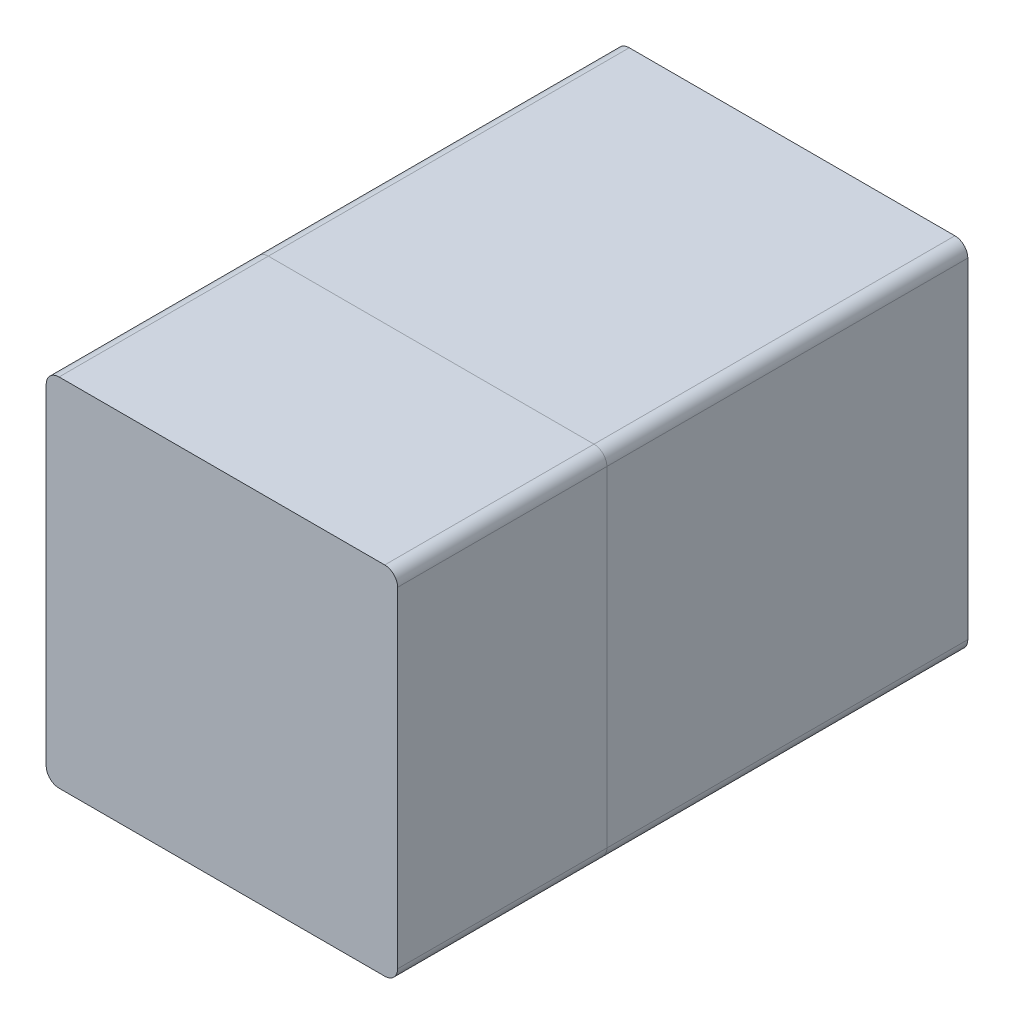
from build123d import *

# Parameters (mm, degrees)
SKETCH1_W           = 73.787
SKETCH1_H           = 72.898
BOSS_EXTRUDE1_DEPTH = 123.698
SHELL1_T            = 4
SKETCH2_W           = 81.787
SKETCH2_H           = 80.898
SKETCH2_W_2         = 73.787
SKETCH2_H_2         = 72.898
BOSS_EXTRUDE2_DEPTH = 1
SKETCH7_W           = 81.787
SKETCH7_H           = 80.898
BOSS_EXTRUDE5_DEPTH = 4
SKETCH3_W           = 81.787
SKETCH3_H           = 132.698
BOSS_EXTRUDE3_DEPTH = 2
SKETCH4_R           = 3.025
CUT_EXTRUDE2_DEPTH  = 5
FILLET1_R           = 3
SKETCH5_W           = 77.787
SKETCH5_H           = 76.898
SKETCH5_W_2         = 73.787
SKETCH5_H_2         = 72.898
BOSS_EXTRUDE4_DEPTH = 20
SKETCH6_W           = 78.087
SKETCH6_H           = 77.198
CUT_EXTRUDE3_DEPTH  = 21


with BuildPart() as part:
    # Sketch1 → Boss-Extrude1 (new body)
    with BuildSketch(Plane.XY):
        Rectangle(SKETCH1_W, SKETCH1_H)
    extrude(amount=BOSS_EXTRUDE1_DEPTH)

    # Shell1
    shell1_openings = [part.faces().sort_by_distance(p)[0] for p in [
        (0, 0, 123.698),
    ]]
    offset(amount=SHELL1_T, openings=shell1_openings, kind=Kind.INTERSECTION)

    # Sketch2 → Boss-Extrude2 (add)
    with BuildSketch(Plane.XY.offset(123.698)):
        Rectangle(SKETCH2_W, SKETCH2_H)
        Rectangle(SKETCH2_W_2, SKETCH2_H_2, mode=Mode.SUBTRACT)
    extrude(amount=BOSS_EXTRUDE2_DEPTH)

    # Sketch7 → Boss-Extrude5 (add)
    with BuildSketch(Plane.XY.offset(124.698)):
        Rectangle(SKETCH7_W, SKETCH7_H)
    extrude(amount=BOSS_EXTRUDE5_DEPTH)

    # Sketch3 → Boss-Extrude3 (add)
    with BuildSketch(Plane.XZ.offset(40.449)):
        with Locations((0, 62.349)):
            Rectangle(SKETCH3_W, SKETCH3_H)
    extrude(amount=BOSS_EXTRUDE3_DEPTH)

    # Sketch4 → Cut-Extrude2 (cut)
    with BuildSketch(Plane.XZ.offset(42.449)):
        with Locations((-22.225, 109.648)):
            Circle(SKETCH4_R)
        with Locations((22.225, 109.648)):
            Circle(SKETCH4_R)
        with Locations((-22.225, 15.05)):
            Circle(SKETCH4_R)
        with Locations((22.225, 15.05)):
            Circle(SKETCH4_R)
    extrude(amount=-CUT_EXTRUDE2_DEPTH, mode=Mode.SUBTRACT)

    # Fillet1
    fillet1_edges = [part.edges().sort_by_distance(p)[0] for p in [
        (-40.8935, -42.449, 62.349),
        (40.8935, -42.449, 62.349),
        (40.8935, 40.449, 62.349),
        (-40.8935, 40.449, 62.349),
    ]]
    fillet(fillet1_edges, radius=FILLET1_R)


with BuildPart() as body_2:
    # Split1: the piece on the far side of the plane
    add(part.part)
    split(bisect_by=Plane.XY.offset(80), keep=Keep.BOTTOM)

    # Sketch5 → Boss-Extrude4 (add)
    with BuildSketch(Plane.XY.offset(80)):
        Rectangle(SKETCH5_W, SKETCH5_H)
        Rectangle(SKETCH5_W_2, SKETCH5_H_2, mode=Mode.SUBTRACT)
    extrude(amount=BOSS_EXTRUDE4_DEPTH)


with BuildPart() as part_1:
    add(part.part)

    # Split1
    split(bisect_by=Plane.XY.offset(80), keep=Keep.TOP)

    # Sketch6 → Cut-Extrude3 (cut)
    with BuildSketch(Plane(origin=(0, 0, 80), x_dir=(-1, 0, 0), z_dir=(0, 0, -1))):
        Rectangle(SKETCH6_W, SKETCH6_H)
    extrude(amount=-CUT_EXTRUDE3_DEPTH, mode=Mode.SUBTRACT)


solid = Compound([body_2.part, part_1.part])
